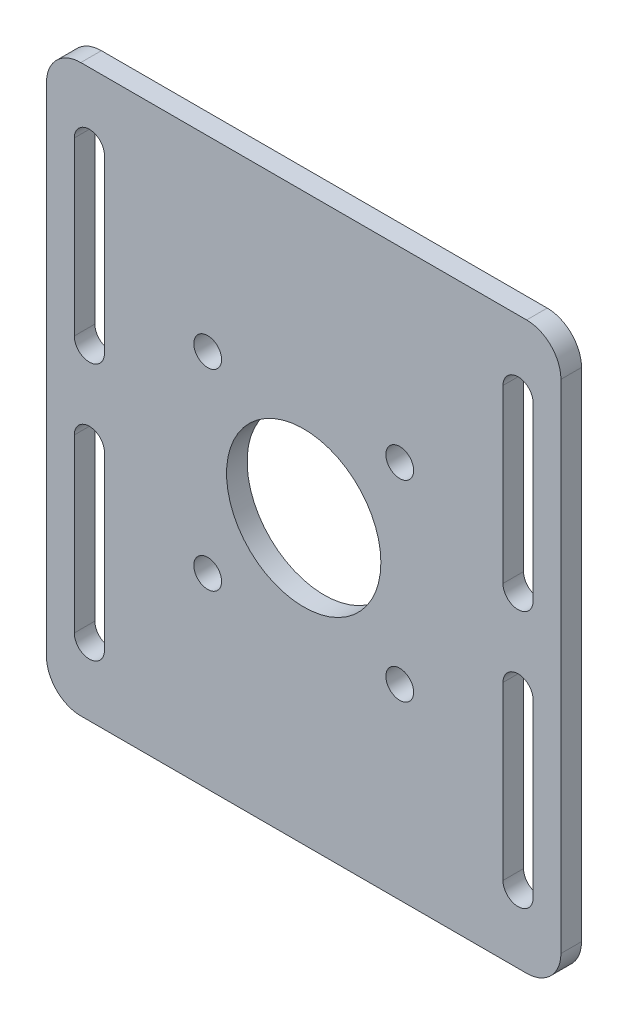
from build123d import *

# Parameters (mm, degrees)
SKETCH_1_W          = 300
SKETCH_1_H          = 330
SKETCH_1_R          = 45
EXTRUDE_1_DEPTH     = 6
FILLET_1_R          = 20
SKETCH_3_R          = 8.1
CUT_EXTRUDE_2_DEPTH = 12
CUT_EXTRUDE_3_DEPTH = 12


with BuildPart() as part:
    # Эскиз1 → Бобышка-Вытянуть1 (new, symmetric)
    with BuildSketch(Plane.XY):
        Rectangle(SKETCH_1_W, SKETCH_1_H)
        Circle(SKETCH_1_R, mode=Mode.SUBTRACT)
    extrude(amount=EXTRUDE_1_DEPTH, both=True)

    # Скругление1
    fillet_1_edges = [part.edges().sort_by_distance(p)[0] for p in [
        (150, -165, 0),
        (-150, -165, 0),
        (-150, 165, 0),
        (150, 165, 0),
    ]]
    fillet(fillet_1_edges, radius=FILLET_1_R)

    # Эскиз3 → Вырез-Вытянуть2 (cut)
    with BuildSketch(Plane.XY.offset(6)):
        with Locations((-56, 56)):
            Circle(SKETCH_3_R)
        with Locations((56, 56)):
            Circle(SKETCH_3_R)
        with Locations((56, -56)):
            Circle(SKETCH_3_R)
        with Locations((-56, -56)):
            Circle(SKETCH_3_R)
    extrude(amount=-CUT_EXTRUDE_2_DEPTH, mode=Mode.SUBTRACT)

    # Эскиз4 → Вырез-Вытянуть3 (cut)
    with BuildSketch(Plane(origin=(0, 0, -6), x_dir=(-1, 0, 0), z_dir=(0, 0, -1))):
        with BuildLine():
            Line((-133.8, 25), (-133.8, 125))
            ThreePointArc((-133.8, 125), (-125, 133.8), (-116.2, 125))
            Line((-116.2, 125), (-116.2, 25))
            ThreePointArc((-116.2, 25), (-125, 16.2), (-133.8, 25))
        make_face()
        with BuildLine():
            Line((-133.8, -25), (-133.8, -125))
            ThreePointArc((-133.8, -125), (-125, -133.8), (-116.2, -125))
            Line((-116.2, -125), (-116.2, -25))
            ThreePointArc((-116.2, -25), (-125, -16.2), (-133.8, -25))
        make_face()
        with BuildLine():
            Line((133.8, -25), (133.8, -125))
            ThreePointArc((133.8, -125), (125, -133.8), (116.2, -125))
            Line((116.2, -125), (116.2, -25))
            ThreePointArc((116.2, -25), (125, -16.2), (133.8, -25))
        make_face()
        with BuildLine():
            Line((133.8, 25), (133.8, 125))
            ThreePointArc((133.8, 125), (125, 133.8), (116.2, 125))
            Line((116.2, 125), (116.2, 25))
            ThreePointArc((116.2, 25), (125, 16.2), (133.8, 25))
        make_face()
    extrude(amount=-CUT_EXTRUDE_3_DEPTH, mode=Mode.SUBTRACT)


solid = part.part
